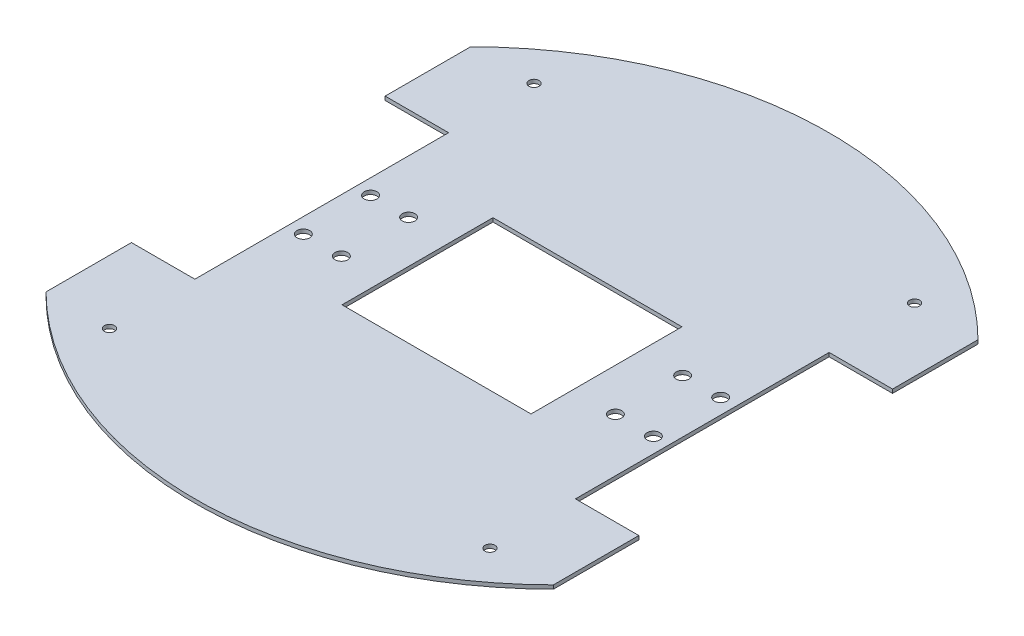
from build123d import *

# Parameters (mm, degrees)
BOSS_EXTRUDE1_DEPTH = 3
SKETCH4_R           = 4
CUT_EXTRUDE1_DEPTH  = 10
SKETCH6_W           = 149
SKETCH6_H           = 119
CUT_EXTRUDE2_DEPTH  = 10
SKETCH7_R           = 5
CUT_EXTRUDE3_DEPTH  = 10


with BuildPart() as part:
    # Sketch3 → Boss-Extrude1 (new body)
    with BuildSketch(Plane(origin=(0, 0, 0), x_dir=(1, 0, 0), z_dir=(0, 1, 0))):
        with BuildLine():
            Line((-150, 100), (-200, 100))
            Line((-200, 100), (-200, 167.359909647))
            ThreePointArc((-200, 167.359909647), (0, 250), (200, 167.359909647))
            Line((200, 167.359909647), (200, 100))
            Line((200, 100), (150, 100))
            Line((150, 100), (150, -100))
            Line((150, -100), (200, -100))
            Line((200, -100), (200, -167.359909647))
            ThreePointArc((200, -167.359909647), (0, -250), (-200, -167.359909647))
            Line((-200, -167.359909647), (-200, -100))
            Line((-200, -100), (-150, -100))
            Line((-150, -100), (-150, 100))
        make_face()
    extrude(amount=BOSS_EXTRUDE1_DEPTH)

    # Sketch4 → Cut-Extrude1 (cut)
    with BuildSketch(Plane(origin=(0, 3, 0), x_dir=(1, 0, 0), z_dir=(0, 1, 0))):
        with Locations(Location((-150, 167.359909647, 0), (0, 0, 270))):
            Circle(SKETCH4_R)
        with Locations(Location((150, 167.359909647, 0), (0, 0, 270))):
            Circle(SKETCH4_R)
        with Locations(Location((150, -167.359909647, 0), (0, 0, 270))):
            Circle(SKETCH4_R)
        with Locations(Location((-150, -167.359909647, 0), (0, 0, 270))):
            Circle(SKETCH4_R)
    extrude(amount=-CUT_EXTRUDE1_DEPTH, mode=Mode.SUBTRACT)

    # Sketch6 → Cut-Extrude2 (cut)
    with BuildSketch(Plane.XZ):
        Rectangle(SKETCH6_W, SKETCH6_H)
    extrude(amount=-CUT_EXTRUDE2_DEPTH, mode=Mode.SUBTRACT)

    # Sketch7 → Cut-Extrude3 (cut)
    with BuildSketch(Plane.XZ):
        with Locations(Location((-138, 26.5, 0), (0, 0, 270))):
            Circle(SKETCH7_R)
        with Locations(Location((-108, 26.5, 0), (0, 0, 270))):
            Circle(SKETCH7_R)
        with Locations(Location((108, 26.5, 0), (0, 0, 270))):
            Circle(SKETCH7_R)
        with Locations(Location((138, 26.5, 0), (0, 0, 270))):
            Circle(SKETCH7_R)
        with Locations(Location((108, -26.5, 0), (0, 0, 270))):
            Circle(SKETCH7_R)
        with Locations(Location((138, -26.5, 0), (0, 0, 270))):
            Circle(SKETCH7_R)
        with Locations(Location((-138, -26.5, 0), (0, 0, 270))):
            Circle(SKETCH7_R)
        with Locations(Location((-108, -26.5, 0), (0, 0, 270))):
            Circle(SKETCH7_R)
    extrude(amount=-CUT_EXTRUDE3_DEPTH, mode=Mode.SUBTRACT)


solid = part.part
